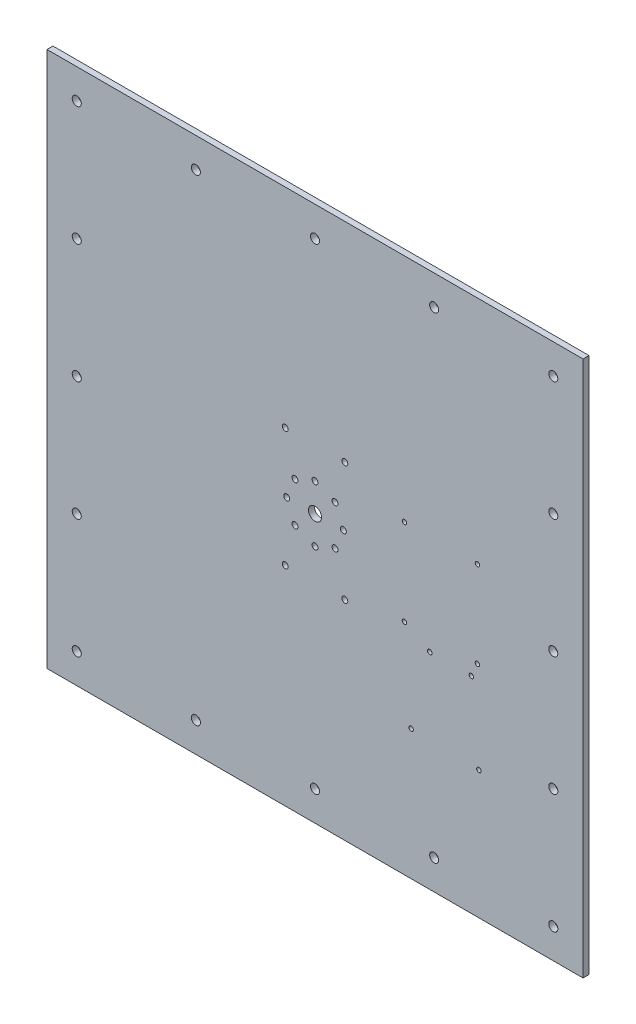
from build123d import *

# Parameters (mm, degrees)
SKETCH_1_W          = 360
SKETCH_1_H          = 360
SKETCH_1_R          = 2
SKETCH_1_R_2        = 4.4
EXTRUDE_1_DEPTH     = 4
SKETCH_2_R          = 1.5
CUT_EXTRUDE_2_DEPTH = 20
SKETCH_3_R          = 3.04
CUT_EXTRUDE_3_DEPTH = 20
SKETCH_4_R          = 2
CUT_EXTRUDE_4_DEPTH = 10


with BuildPart() as part:
    # 草图1 → 凸台-拉伸1 (new body)
    with BuildSketch(Plane.XY):
        with Locations((-20, -0.443736876)):
            Rectangle(SKETCH_1_W, SKETCH_1_H)
        with Locations((-40, 39.556263124)):
            Circle(SKETCH_1_R, mode=Mode.SUBTRACT)
        with Locations((0, 39.556263124)):
            Circle(SKETCH_1_R, mode=Mode.SUBTRACT)
        with Locations(Location((0, -40.443736876, 0), (0, 0, 180))):
            Circle(SKETCH_1_R, mode=Mode.SUBTRACT)
        with Locations(Location((-40, -40.443736876, 0), (0, 0, 180))):
            Circle(SKETCH_1_R, mode=Mode.SUBTRACT)
        with Locations((-20, -0.443736876)):
            Circle(SKETCH_1_R_2, mode=Mode.SUBTRACT)
    extrude(amount=EXTRUDE_1_DEPTH)

    # 草图2 → 切除-拉伸2 (cut)
    with BuildSketch(Plane.XY.offset(4)):
        with Locations((57.061153948, -42.313752709)):
            Circle(SKETCH_2_R)
        with Locations((84.961153948, -42.313752709)):
            Circle(SKETCH_2_R)
        with Locations((44.561153948, -93.113752709)):
            Circle(SKETCH_2_R)
        with Locations((90.061153948, -94.413752709)):
            Circle(SKETCH_2_R)
        with Locations((40.061153948, 24.768466173)):
            Circle(SKETCH_2_R)
        with Locations((89.061153948, 24.768466173)):
            Circle(SKETCH_2_R)
        with Locations((40.061153948, -33.231533827)):
            Circle(SKETCH_2_R)
        with Locations((89.061153948, -33.231533827)):
            Circle(SKETCH_2_R)
    extrude(amount=-CUT_EXTRUDE_2_DEPTH, mode=Mode.SUBTRACT)

    # 草图3 → 切除-拉伸3 (cut)
    with BuildSketch(Plane.XY.offset(4)):
        with Locations((-180, -160.443736876)):
            Circle(SKETCH_3_R)
        with Locations((-180, -80.443736876)):
            Circle(SKETCH_3_R)
        with Locations((-180, -0.443736876)):
            Circle(SKETCH_3_R)
        with Locations((-180, 79.556263124)):
            Circle(SKETCH_3_R)
        with Locations((-180, 159.556263124)):
            Circle(SKETCH_3_R)
        with Locations((-100, 159.556263124)):
            Circle(SKETCH_3_R)
        with Locations((-20, 159.556263124)):
            Circle(SKETCH_3_R)
        with Locations((60, 159.556263124)):
            Circle(SKETCH_3_R)
        with Locations((140, 159.556263124)):
            Circle(SKETCH_3_R)
        with Locations((140, 79.556263124)):
            Circle(SKETCH_3_R)
        with Locations((140, -0.443736876)):
            Circle(SKETCH_3_R)
        with Locations((140, -80.443736876)):
            Circle(SKETCH_3_R)
        with Locations((140, -160.443736876)):
            Circle(SKETCH_3_R)
        with Locations((60, -160.443736876)):
            Circle(SKETCH_3_R)
        with Locations((-20, -160.443736876)):
            Circle(SKETCH_3_R)
        with Locations((-100, -160.443736876)):
            Circle(SKETCH_3_R)
    extrude(amount=-CUT_EXTRUDE_3_DEPTH, mode=Mode.SUBTRACT)

    # 草图4 → 切除-拉伸4 (cut)
    with BuildSketch(Plane.XY.offset(4)):
        with Locations((-20, -19.443736876)):
            Circle(SKETCH_4_R)
        with Locations((-33.435028843, -13.878765719)):
            Circle(SKETCH_4_R)
        with Locations((-39, -0.443736876)):
            Circle(SKETCH_4_R)
        with Locations((-33.435028843, 12.991291966)):
            Circle(SKETCH_4_R)
        with Locations((-20, 18.556263124)):
            Circle(SKETCH_4_R)
        with Locations((-6.564971157, 12.991291966)):
            Circle(SKETCH_4_R)
        with Locations((-1, -0.443736876)):
            Circle(SKETCH_4_R)
        with Locations((-6.564971157, -13.878765719)):
            Circle(SKETCH_4_R)
    extrude(amount=-CUT_EXTRUDE_4_DEPTH, mode=Mode.SUBTRACT)


solid = part.part
